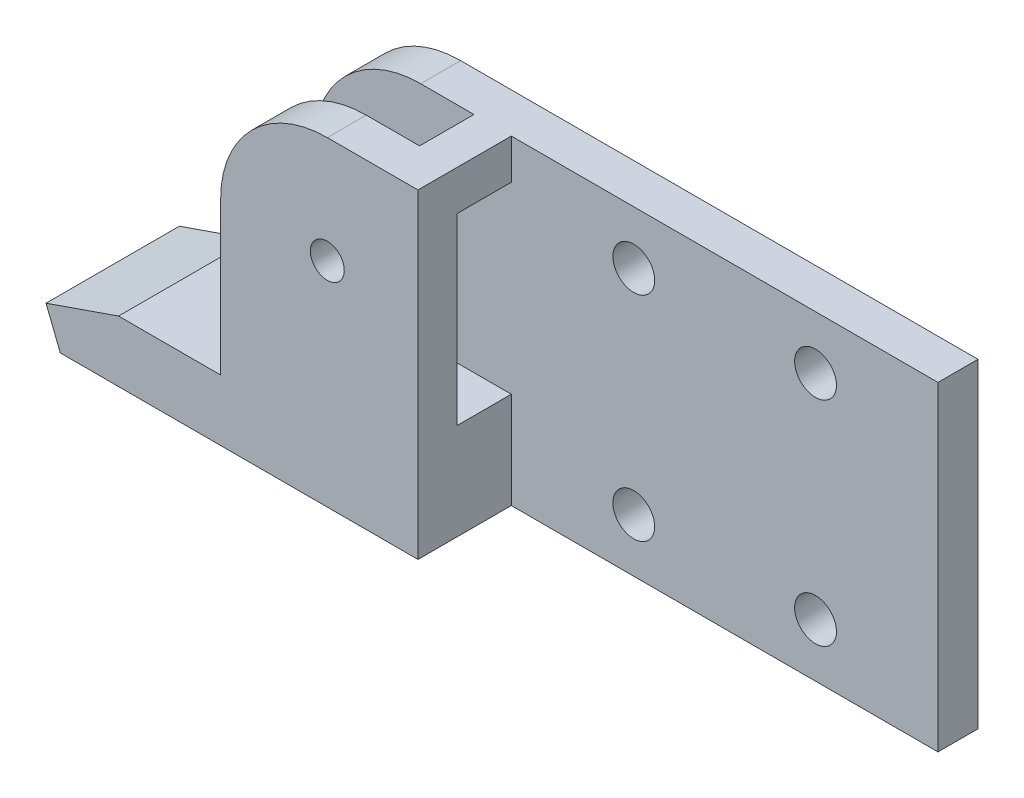
from build123d import *

# Parameters (mm, degrees)
SKETCH2_R                  = 3.175
BOSS_EXTRUDE1_DEPTH        = 4.7625
BOSS_EXTRUDE2_DEPTH        = 11.1125
SKETCH12_W                 = 6.477
SKETCH12_H                 = 21.856650617
CUT_EXTRUDE1_DEPTH         = 24.13
SKETCH12_3_W               = 6.477
SKETCH12_3_H               = 4.7625
CUT_EXTRUDE2_DEPTH         = 19.05
TAP_DRILL_FOR_10_32_TAP1_D = 4.0386
F_10_CLEARANCE_HOLE2_D     = 4.9784


with BuildPart() as part:
    # Sketch2 → Boss-Extrude1 (new body)
    with BuildSketch(Plane.XY):
        with BuildLine():
            Line((-67.986186343, -228.533359856), (-69.686856366, -224.252380141))
            Line((-69.686856366, -224.252380141), (-61.0470258, -221.260552334))
            Line((-61.0470258, -221.260552334), (-48.895, -221.260552334))
            Line((-48.895, -221.260552334), (-48.895, -203.133359856))
            ThreePointArc((-48.895, -203.133359856), (-45.175256121, -194.153103735), (-36.195, -190.433359856))
            Line((-36.195, -190.433359856), (25.4, -190.433359856))
            Line((25.4, -190.433359856), (25.4, -228.533359856))
            Line((25.4, -228.533359856), (-67.986186343, -228.533359856))
        make_face()
        with Locations((-36.195, -203.133359856)):
            Circle(SKETCH2_R, mode=Mode.SUBTRACT)
    extrude(amount=BOSS_EXTRUDE1_DEPTH)

    # Sketch11 → Boss-Extrude2 (add)
    with BuildSketch(Plane(origin=(0, 0, 4.7625), x_dir=(-1, 0, 0), z_dir=(0, 0, -1))):
        with BuildLine():
            Line((25.4, -190.433359856), (25.4, -228.533359856))
            Line((25.4, -228.533359856), (67.986186343, -228.533359856))
            Line((67.986186343, -228.533359856), (69.686856366, -224.252380141))
            Line((69.686856366, -224.252380141), (61.0470258, -221.260552334))
            Line((61.0470258, -221.260552334), (48.895, -221.260552334))
            Line((48.895, -221.260552334), (48.895, -203.133359856))
            ThreePointArc((48.895, -203.133359856), (45.175256121, -194.153103735), (36.195, -190.433359856))
            Line((36.195, -190.433359856), (25.4, -190.433359856))
        make_face()
    extrude(amount=-BOSS_EXTRUDE2_DEPTH)

    # Sketch12 → Cut-Extrude1 (cut)
    with BuildSketch(Plane.ZY.offset(48.895)):
        with Locations((8.001, -206.124185165)):
            Rectangle(SKETCH12_W, SKETCH12_H)
    extrude(amount=-CUT_EXTRUDE1_DEPTH, mode=Mode.SUBTRACT)

    # Sketch12<3> → Cut-Extrude2 (cut)
    with BuildSketch(Plane.ZY.offset(48.895)):
        with Locations((8.001, -192.814609856)):
            Rectangle(SKETCH12_3_W, SKETCH12_3_H)
    extrude(amount=-CUT_EXTRUDE2_DEPTH, mode=Mode.SUBTRACT)

    # Tap Drill for #10-32 Tap1 (through all)
    with Locations(Plane(origin=(0, 0, 11.2395), x_dir=(1, 0, 0), z_dir=(0, 0, -1))):
        with Locations((-36.195, 203.133359856)):
            Hole(TAP_DRILL_FOR_10_32_TAP1_D / 2)

    # #10 Clearance Hole2 (through all)
    with Locations(Plane.XY.offset(4.7625)):
        with Locations((-10.8204, -196.783359856), (-10.8204, -222.183359856), (10.8204, -222.183359856), (10.8204, -196.783359856)):
            Hole(F_10_CLEARANCE_HOLE2_D / 2)


solid = part.part
